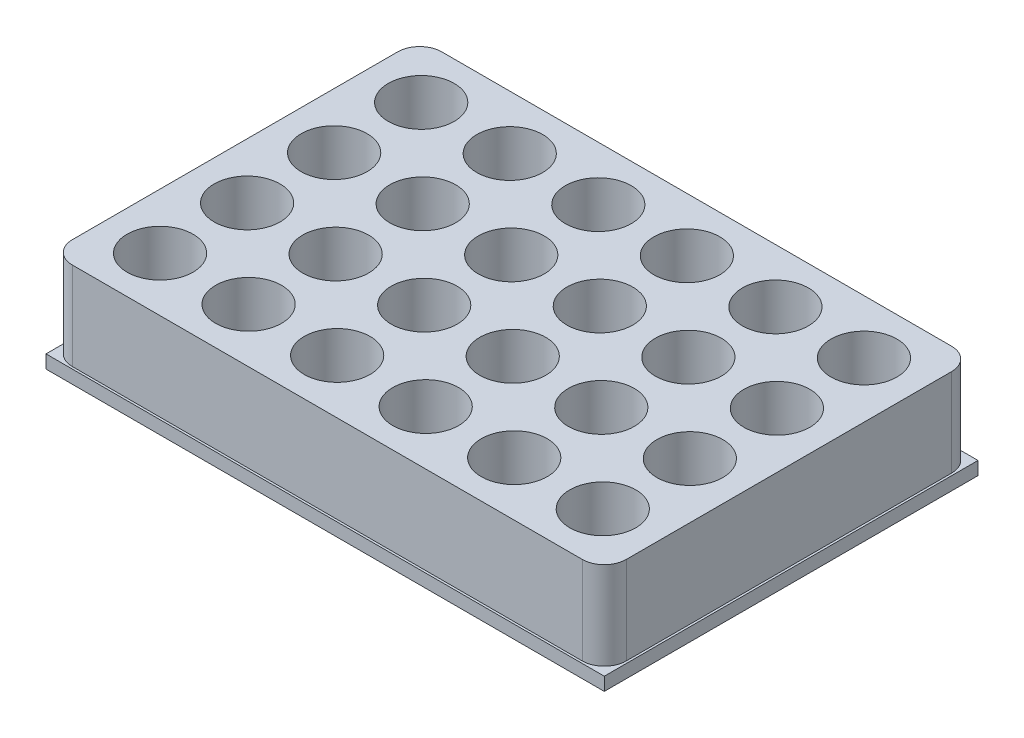
from build123d import *

# Parameters (mm, degrees)
SKETCH1_W           = 125.98
SKETCH1_H           = 84
SKETCH1_R           = 7.5
BOSS_EXTRUDE1_DEPTH = 20
SKETCH2_W           = 126.98
SKETCH2_H           = 85
BOSS_EXTRUDE3_DEPTH = 3
FILLET2_R           = 5


with BuildPart() as part:
    # Sketch1 → Boss-Extrude1 (new body)
    with BuildSketch(Plane(origin=(0, 0, 0), x_dir=(1, 0, 0), z_dir=(0, 1, 0))):
        with Locations((62.99, 42)):
            Rectangle(SKETCH1_W, SKETCH1_H)
        with Locations(Location((12.64, 12.3, 0), (0, 0, 270))):
            Circle(SKETCH1_R, mode=Mode.SUBTRACT)
        with Locations(Location((32.78, 12.3, 0), (0, 0, 270))):
            Circle(SKETCH1_R, mode=Mode.SUBTRACT)
        with Locations(Location((52.92, 12.3, 0), (0, 0, 270))):
            Circle(SKETCH1_R, mode=Mode.SUBTRACT)
        with Locations(Location((73.06, 12.3, 0), (0, 0, 270))):
            Circle(SKETCH1_R, mode=Mode.SUBTRACT)
        with Locations(Location((93.2, 12.3, 0), (0, 0, 270))):
            Circle(SKETCH1_R, mode=Mode.SUBTRACT)
        with Locations(Location((113.34, 12.3, 0), (0, 0, 270))):
            Circle(SKETCH1_R, mode=Mode.SUBTRACT)
        with Locations(Location((32.78, 32.1, 0), (0, 0, 270))):
            Circle(SKETCH1_R, mode=Mode.SUBTRACT)
        with Locations(Location((52.92, 32.1, 0), (0, 0, 270))):
            Circle(SKETCH1_R, mode=Mode.SUBTRACT)
        with Locations(Location((73.06, 32.1, 0), (0, 0, 270))):
            Circle(SKETCH1_R, mode=Mode.SUBTRACT)
        with Locations(Location((93.2, 32.1, 0), (0, 0, 270))):
            Circle(SKETCH1_R, mode=Mode.SUBTRACT)
        with Locations(Location((113.34, 32.1, 0), (0, 0, 270))):
            Circle(SKETCH1_R, mode=Mode.SUBTRACT)
        with Locations(Location((32.78, 51.9, 0), (0, 0, 270))):
            Circle(SKETCH1_R, mode=Mode.SUBTRACT)
        with Locations(Location((52.92, 51.9, 0), (0, 0, 270))):
            Circle(SKETCH1_R, mode=Mode.SUBTRACT)
        with Locations(Location((73.06, 51.9, 0), (0, 0, 270))):
            Circle(SKETCH1_R, mode=Mode.SUBTRACT)
        with Locations(Location((93.2, 51.9, 0), (0, 0, 270))):
            Circle(SKETCH1_R, mode=Mode.SUBTRACT)
        with Locations(Location((113.34, 51.9, 0), (0, 0, 270))):
            Circle(SKETCH1_R, mode=Mode.SUBTRACT)
        with Locations(Location((32.78, 71.7, 0), (0, 0, 270))):
            Circle(SKETCH1_R, mode=Mode.SUBTRACT)
        with Locations(Location((52.92, 71.7, 0), (0, 0, 270))):
            Circle(SKETCH1_R, mode=Mode.SUBTRACT)
        with Locations(Location((73.06, 71.7, 0), (0, 0, 270))):
            Circle(SKETCH1_R, mode=Mode.SUBTRACT)
        with Locations(Location((93.2, 71.7, 0), (0, 0, 270))):
            Circle(SKETCH1_R, mode=Mode.SUBTRACT)
        with Locations(Location((113.34, 71.7, 0), (0, 0, 270))):
            Circle(SKETCH1_R, mode=Mode.SUBTRACT)
        with Locations(Location((12.64, 32.1, 0), (0, 0, 270))):
            Circle(SKETCH1_R, mode=Mode.SUBTRACT)
        with Locations(Location((12.64, 51.9, 0), (0, 0, 270))):
            Circle(SKETCH1_R, mode=Mode.SUBTRACT)
        with Locations(Location((12.64, 71.7, 0), (0, 0, 270))):
            Circle(SKETCH1_R, mode=Mode.SUBTRACT)
    extrude(amount=BOSS_EXTRUDE1_DEPTH)

    # Sketch2 → Boss-Extrude3 (add)
    with BuildSketch(Plane.XZ):
        with Locations((62.99, -42)):
            Rectangle(SKETCH2_W, SKETCH2_H)
    extrude(amount=BOSS_EXTRUDE3_DEPTH)

    # Fillet2
    fillet2_edges = [part.edges().sort_by_distance(p)[0] for p in [
        (0, 10, -84),
        (125.98, 10, -84),
        (125.98, 10, 0),
        (0, 10, 0),
    ]]
    fillet(fillet2_edges, radius=FILLET2_R)


solid = part.part
